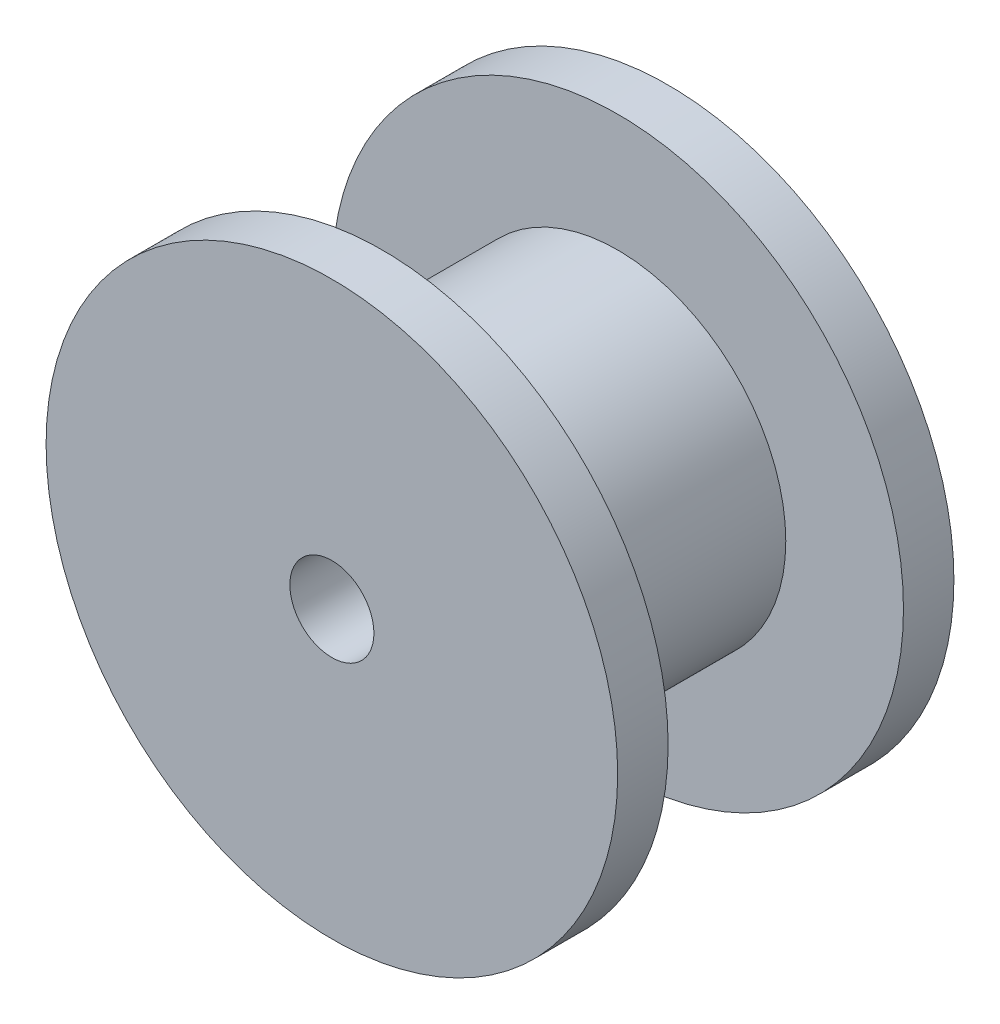
from build123d import *

# Parameters (mm, degrees)
TALADRO_ROSCADO_M2_52_D = 2.5


with BuildPart() as part:
    # Sketch2 → Revolve1 (revolve)
    with BuildSketch(Plane(origin=(0, 0, 0), x_dir=(1, 0, 0), z_dir=(0, 1, 0)), mode=Mode.PRIVATE) as revolve1_sk:
        Polygon((0, 10), (-8.5, 10), (-8.5, 8.5), (-5, 8.5), (-5, 1.5), (-8.5, 1.5), (-8.5, 0), (0, 0), align=None)
    revolve(revolve1_sk.sketch.rotate(Axis((0, 0, 198.467795094), (0, 0, -1)), 180), axis=Axis((0, 0, 198.467795094), (0, 0, -1)))

    # Taladro roscado M2.52 (through all)
    with Locations(Plane.XY):
        with Locations((0, 0)):
            Hole(TALADRO_ROSCADO_M2_52_D / 2)


solid = part.part
